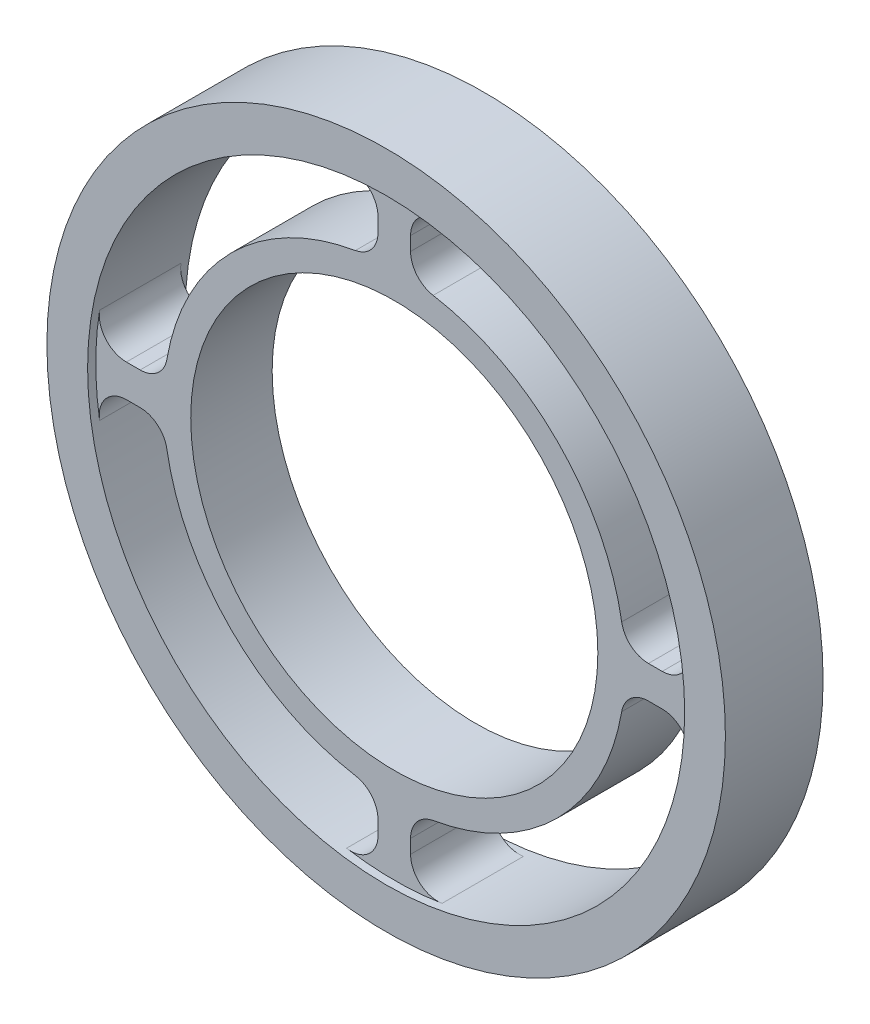
from build123d import *

# Parameters (mm, degrees)
SKETCH_1_R          = 8.5
SKETCH_1_R_2        = 7.5
EXTRUDE_1_DEPTH     = 3.6
SKETCH_2_R          = 12.5
SKETCH_2_R_2        = 11
EXTRUDE_2_DEPTH     = 3.6
EXTRUDE_START       = -3
EXTRUDE_3_DEPTH     = 3
FILLET_1_R          = 1
CUT_EXTRUDE_START   = -0.3
SKETCH_5_R          = 8.5
SKETCH_5_R_2        = 7.5
CUT_EXTRUDE_1_DEPTH = 0.3
SKETCH_6_R          = 8.5
SKETCH_6_R_2        = 7.5
CUT_EXTRUDE_2_DEPTH = 0.3


with BuildPart() as part:
    # 草图1 → 凸台-拉伸1 (new body)
    with BuildSketch(Plane.XY):
        Circle(SKETCH_1_R)
        Circle(SKETCH_1_R_2, mode=Mode.SUBTRACT)
    extrude(amount=EXTRUDE_1_DEPTH)



with BuildPart() as body_2:
    # 草图2 → 凸台-拉伸2 (new body)
    with BuildSketch(Plane.XY.offset(3.6)):
        Circle(SKETCH_2_R)
        Circle(SKETCH_2_R_2, mode=Mode.SUBTRACT)
    extrude(amount=-EXTRUDE_2_DEPTH)


with BuildPart() as part_1:
    add(part.part)

    add(body_2.part)  # 凸台-拉伸3 merges body 2
    # 草图4 → 凸台-拉伸3 (add)
    with BuildSketch(Plane.XY.offset(3.3).offset(EXTRUDE_START)):
        with BuildLine():
            ThreePointArc((-0.6, 8.478797084), (0, 8.5), (0.6, 8.478797084))
            Line((0.6, 8.478797084), (0.6, 10.983624174))
            ThreePointArc((0.6, 10.983624174), (0, 11), (-0.6, 10.983624174))
            Line((-0.6, 10.983624174), (-0.6, 8.478797084))
        make_face()
        with BuildLine():
            Line((-11, 0), (-8.5, 0))
            ThreePointArc((-8.5, 0), (-8.494697617, 0.30018726), (-8.478797084, 0.6))
            Line((-8.478797084, 0.6), (-10.983624174, 0.6))
            ThreePointArc((-10.983624174, 0.6), (-10.995905281, 0.300111716), (-11, 0))
        make_face()
        with BuildLine():
            Line((0.6, -10.983624174), (0.6, -8.478797084))
            ThreePointArc((0.6, -8.478797084), (0, -8.5), (-0.6, -8.478797084))
            Line((-0.6, -8.478797084), (-0.6, -10.983624174))
            ThreePointArc((-0.6, -10.983624174), (0, -11), (0.6, -10.983624174))
        make_face()
        with BuildLine():
            ThreePointArc((8.478797084, 0.6), (8.494697617, 0.30018726), (8.5, 0))
            Line((8.5, 0), (11, 0))
            ThreePointArc((11, 0), (10.995905281, 0.300111716), (10.983624174, 0.6))
            Line((10.983624174, 0.6), (8.478797084, 0.6))
        make_face()
        with BuildLine():
            Line((8, 0), (8.5, 0))
            ThreePointArc((8.5, 0), (8.494697617, 0.30018726), (8.478797084, 0.6))
            Line((8.478797084, 0.6), (8, 0.6))
            Line((8, 0.6), (8, 0))
        make_face()
        with BuildLine():
            ThreePointArc((10.983624174, 0.6), (10.995905281, 0.300111716), (11, 0))
            ThreePointArc((11, 0), (10.995905281, -0.300111716), (10.983624174, -0.6))
            Line((10.983624174, -0.6), (11.5, -0.6))
            Line((11.5, -0.6), (11.5, 0.6))
            Line((11.5, 0.6), (10.983624174, 0.6))
        make_face()
        with BuildLine():
            Line((11, 0), (8.5, 0))
            ThreePointArc((8.5, 0), (8.494697617, -0.30018726), (8.478797084, -0.6))
            Line((8.478797084, -0.6), (10.983624174, -0.6))
            ThreePointArc((10.983624174, -0.6), (10.995905281, -0.300111716), (11, 0))
        make_face()
        with BuildLine():
            ThreePointArc((8.478797084, -0.6), (8.494697617, -0.30018726), (8.5, 0))
            Line((8.5, 0), (8, 0))
            Line((8, 0), (8, -0.6))
            Line((8, -0.6), (8.478797084, -0.6))
        make_face()
        with BuildLine():
            Line((0.6, -11.5), (0.6, -10.983624174))
            ThreePointArc((0.6, -10.983624174), (0, -11), (-0.6, -10.983624174))
            Line((-0.6, -10.983624174), (-0.6, -11.5))
            Line((-0.6, -11.5), (0.6, -11.5))
        make_face()
        with BuildLine():
            ThreePointArc((-0.6, -8.478797084), (0, -8.5), (0.6, -8.478797084))
            Line((0.6, -8.478797084), (0.6, -8))
            Line((0.6, -8), (-0.6, -8))
            Line((-0.6, -8), (-0.6, -8.478797084))
        make_face()
        with BuildLine():
            ThreePointArc((-10.983624174, -0.6), (-10.995905281, -0.300111716), (-11, 0))
            ThreePointArc((-11, 0), (-10.995905281, 0.300111716), (-10.983624174, 0.6))
            Line((-10.983624174, 0.6), (-11.5, 0.6))
            Line((-11.5, 0.6), (-11.5, -0.6))
            Line((-11.5, -0.6), (-10.983624174, -0.6))
        make_face()
        with BuildLine():
            ThreePointArc((-8.478797084, -0.6), (-8.494697617, -0.30018726), (-8.5, 0))
            Line((-8.5, 0), (-11, 0))
            ThreePointArc((-11, 0), (-10.995905281, -0.300111716), (-10.983624174, -0.6))
            Line((-10.983624174, -0.6), (-8.478797084, -0.6))
        make_face()
        with BuildLine():
            Line((-8, -0.6), (-8, 0))
            Line((-8, 0), (-8.5, 0))
            ThreePointArc((-8.5, 0), (-8.494697617, -0.30018726), (-8.478797084, -0.6))
            Line((-8.478797084, -0.6), (-8, -0.6))
        make_face()
        with BuildLine():
            Line((-8.5, 0), (-8, 0))
            Line((-8, 0), (-8, 0.6))
            Line((-8, 0.6), (-8.478797084, 0.6))
            ThreePointArc((-8.478797084, 0.6), (-8.494697617, 0.30018726), (-8.5, 0))
        make_face()
        with BuildLine():
            ThreePointArc((-0.6, 10.983624174), (0, 11), (0.6, 10.983624174))
            Line((0.6, 10.983624174), (0.6, 11.5))
            Line((0.6, 11.5), (-0.6, 11.5))
            Line((-0.6, 11.5), (-0.6, 10.983624174))
        make_face()
        with BuildLine():
            Line((0.6, 8), (0.6, 8.478797084))
            ThreePointArc((0.6, 8.478797084), (0, 8.5), (-0.6, 8.478797084))
            Line((-0.6, 8.478797084), (-0.6, 8))
            Line((-0.6, 8), (0.6, 8))
        make_face()
    extrude(amount=EXTRUDE_3_DEPTH)

    # 圆角1
    fillet_1_edges = [part_1.edges().sort_by_distance(p)[0] for p in [
        (0.6, 10.983624174, 1.8),
        (0.6, 8.478797084, 1.8),
        (-0.6, 8.478797084, 1.8),
        (8.478797084, -0.6, 1.8),
        (8.478797084, 0.6, 1.8),
        (10.983624174, 0.6, 1.8),
        (10.983624174, -0.6, 1.8),
        (0.6, -10.983624174, 1.8),
        (-0.6, -10.983624174, 1.8),
        (-0.6, -8.478797084, 1.8),
        (0.6, -8.478797084, 1.8),
        (-10.983624174, -0.6, 1.8),
        (-10.983624174, 0.6, 1.8),
        (-8.478797084, 0.6, 1.8),
        (-8.478797084, -0.6, 1.8),
        (-0.6, 10.983624174, 1.8),
    ]]
    fillet(fillet_1_edges, radius=FILLET_1_R)

    # 草图5 → 切除-拉伸1 (cut)
    with BuildSketch(Plane.XY.offset(3.6).offset(CUT_EXTRUDE_START)):
        with Locations(Location((0, 0, 0), (0, 0, 170.303971602))):
            Circle(SKETCH_5_R)
        Circle(SKETCH_5_R_2, mode=Mode.SUBTRACT)
    extrude(amount=CUT_EXTRUDE_1_DEPTH, mode=Mode.SUBTRACT)

    # 草图6 → 切除-拉伸2 (cut)
    with BuildSketch(Plane(origin=(0, 0, 0), x_dir=(-1, 0, 0), z_dir=(0, 0, -1))):
        Circle(SKETCH_6_R)
        Circle(SKETCH_6_R_2, mode=Mode.SUBTRACT)
    extrude(amount=-CUT_EXTRUDE_2_DEPTH, mode=Mode.SUBTRACT)


solid = part_1.part
